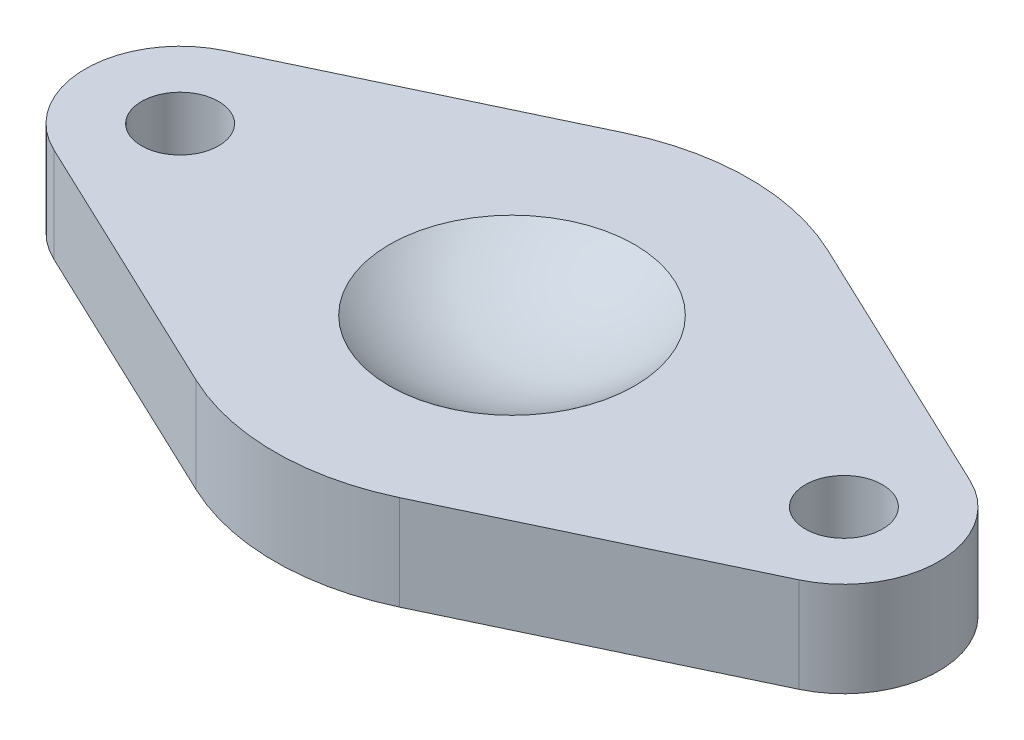
from build123d import *

# Parameters (mm, degrees)
CROQUIS1_W              = 36
CROQUIS1_H              = 20.3
CROQUIS1_R              = 1.625
SALIENTE_EXTRUIR1_DEPTH = 4
CORTAR_EXTRUIR2_DEPTH   = 28.424259334


with BuildPart() as part:
    # Croquis1 → Saliente-Extruir1 (new body)
    with BuildSketch(Plane(origin=(0, 0, 0), x_dir=(1, 0, 0), z_dir=(0, 1, 0))):
        with Locations((0, 10.15)):
            Rectangle(CROQUIS1_W, CROQUIS1_H)
        with Locations(Location((-14, 10.15, 0), (0, 0, 270))):
            Circle(CROQUIS1_R, mode=Mode.SUBTRACT)
        with Locations(Location((14, 10.15, 0), (0, 0, 90))):
            Circle(CROQUIS1_R, mode=Mode.SUBTRACT)
    extrude(amount=SALIENTE_EXTRUIR1_DEPTH)

    # Croquis2 → Cortar-Revolución1 (revolve, cut)
    with BuildSketch(Plane.XY.offset(-10.15)):
        with BuildLine():
            Line((0, 18.45), (0, 2.15))
            ThreePointArc((0, 2.15), (-8.15, 10.3), (0, 18.45))
        make_face()
    revolve(axis=Axis((0, -1000, -10.15), (0, 1, 0)), mode=Mode.SUBTRACT)

    # Croquis3 → Cortar-Extruir2 (cut, through all)
    with BuildSketch(Plane(origin=(0, 4, 0), x_dir=(1, 0, 0), z_dir=(0, 1, 0))):
        with BuildLine():
            ThreePointArc((-18, 10.15), (-17.380616997, 12.288089971), (-15.714285638, 13.764031648))
            Line((-15.714285638, 13.764031648), (-4.285714096, 19.185078825))
            ThreePointArc((-4.285714096, 19.185078825), (1.05e-07, 20.149999706), (4.285714286, 19.185078735))
            Line((4.285714286, 19.185078735), (15.714285714, 13.764031612))
            ThreePointArc((15.714285714, 13.764031612), (17.380617007, 12.288089954), (18, 10.150000044))
            Line((18, 10.150000044), (18, 20.3))
            Line((18, 20.3), (-18, 20.3))
            Line((-18, 20.3), (-18, 10.15))
        make_face()
        with BuildLine():
            ThreePointArc((-15.714285714, 6.535968388), (-17.380617019, 8.011910065), (-18, 10.15))
            Line((-18, 10.15), (-18, -5.88e-07))
            Line((-18, -5.88e-07), (18, -5.88e-07))
            Line((18, -5.88e-07), (18, 10.150000044))
            ThreePointArc((18, 10.150000044), (17.380617031, 8.011910083), (15.714285714, 6.535968388))
            Line((15.714285714, 6.535968388), (4.285714286, 1.114920677))
            ThreePointArc((4.285714286, 1.114920677), (0, 0.149999706), (-4.285714286, 1.114920677))
            Line((-4.285714286, 1.114920677), (-15.714285714, 6.535968388))
        make_face()
    extrude(amount=-CORTAR_EXTRUIR2_DEPTH, mode=Mode.SUBTRACT)


solid = part.part
